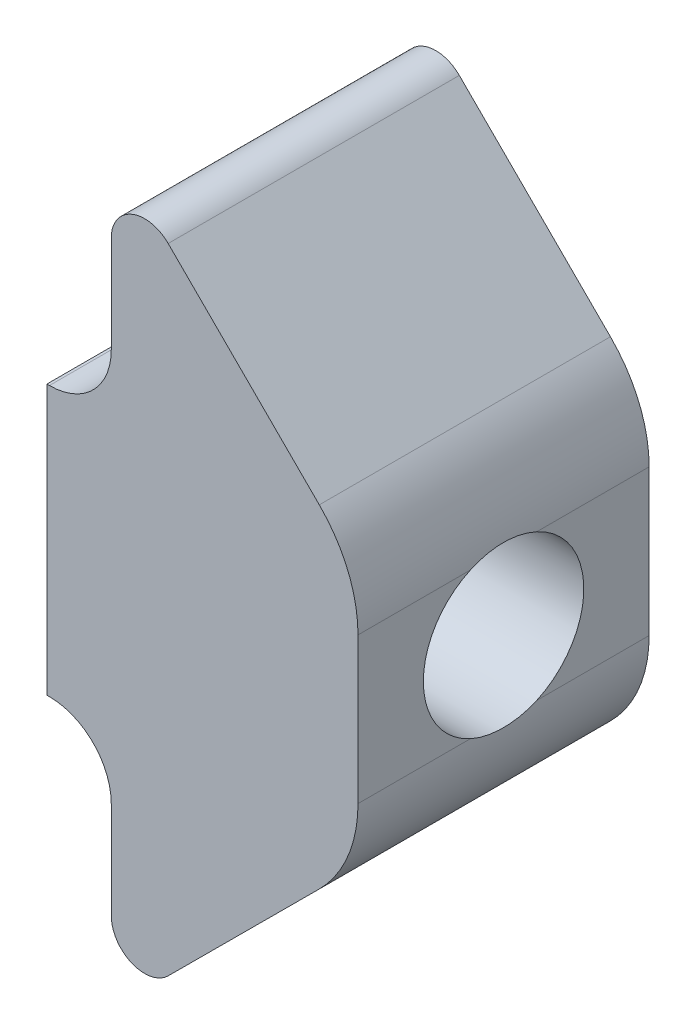
from build123d import *

# Parameters (mm, degrees)
BOSS_EXTRUDE1_DEPTH = 6.35
CUT_EXTRUDE1_REACH  = 13.714
SKETCH2_R           = 1.75
FILLET1_R           = 0.2


with BuildPart() as part:
    # Sketch1 → Boss-Extrude1 (new body)
    with BuildSketch(Plane.XY):
        with BuildLine():
            Line((-11.5951, -2.938456882), (-11.5951, 2.938456882))
            Line((-11.5951, 2.938456882), (-11.539212407, 2.938456882))
            ThreePointArc((-11.539212407, 2.938456882), (-10.585316586, 3.333573468), (-10.1902, 4.287469289))
            Line((-10.1902, 4.287469289), (-10.1902, 6.402089023))
            ThreePointArc((-10.1902, 6.402089023), (-9.74154152, 7.073969797), (-8.94902056, 6.917034355))
            Line((-8.94902056, 6.917034355), (-5.652895046, 3.628441884))
            ThreePointArc((-5.652895046, 3.628441884), (-5.027976112, 2.694919539), (-4.8085, 1.593185507))
            Line((-4.8085, 1.593185507), (-4.8085, -1.593185507))
            ThreePointArc((-4.8085, -1.593185507), (-5.027976112, -2.694919539), (-5.652895046, -3.628441884))
            Line((-5.652895046, -3.628441884), (-8.94902056, -6.917034355))
            ThreePointArc((-8.94902056, -6.917034355), (-9.74154152, -7.073969797), (-10.1902, -6.402089023))
            Line((-10.1902, -6.402089023), (-10.1902, -4.287469289))
            ThreePointArc((-10.1902, -4.287469289), (-10.585316586, -3.333573468), (-11.539212407, -2.938456882))
            Line((-11.539212407, -2.938456882), (-11.5951, -2.938456882))
        make_face()
    extrude(amount=BOSS_EXTRUDE1_DEPTH)

    # Sketch2 → Cut-Extrude1 (cut, up to next)
    with BuildSketch(Plane.ZY.offset(11.5951), mode=Mode.PRIVATE) as cut_extrude1_sk1:
        with Locations((3.175, 0)):
            Circle(SKETCH2_R)
    cut_extrude1_tool1 = extrude(cut_extrude1_sk1.sketch, amount=-CUT_EXTRUDE1_REACH, mode=Mode.PRIVATE) & part.part
    add(cut_extrude1_tool1.solids().sort_by_distance((-11.5951, 0, 3.175))[0], mode=Mode.SUBTRACT)

    # Fillet1
    fillet1_edges = [part.edges().sort_by_distance(p)[0] for p in [
        (-11.5951, 0, 1.425),
    ]]
    fillet(fillet1_edges, radius=FILLET1_R)


solid = part.part
